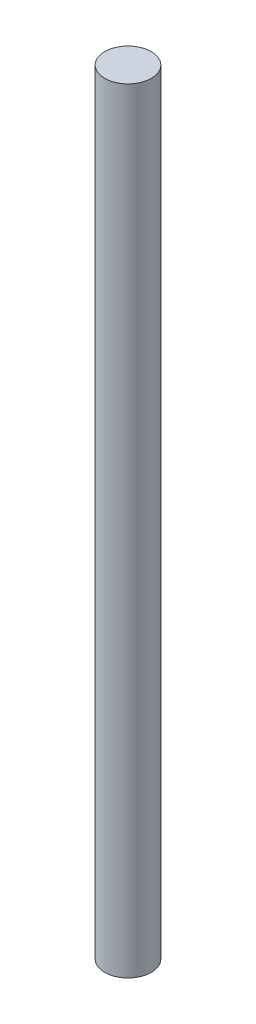
from build123d import *

# Parameters (mm, degrees)
SKIZZE2_R                       = 3
AUFSATZ_LINEAR_AUSTRAGEN1_DEPTH = 100
SKIZZE3_R                       = 1.65
SCHNITT_LINEAR_AUSTRAGEN1_DEPTH = 4


with BuildPart() as part:
    # Skizze2 → Aufsatz-Linear austragen1 (new body)
    with BuildSketch(Plane(origin=(0, 0, 0), x_dir=(1, 0, 0), z_dir=(0, 1, 0))):
        with Locations(Location((0, 0, 0), (0, 0, 270))):
            Circle(SKIZZE2_R)
    extrude(amount=AUFSATZ_LINEAR_AUSTRAGEN1_DEPTH)

    # Skizze3 → Schnitt-Linear austragen1 (cut)
    with BuildSketch(Plane(origin=(0, 0, 0), x_dir=(-1, 0, 0), z_dir=(0, -1, 0))):
        with Locations(Location((0, 0, 0), (0, 0, 90))):
            Circle(SKIZZE3_R)
    extrude(amount=-SCHNITT_LINEAR_AUSTRAGEN1_DEPTH, mode=Mode.SUBTRACT)


solid = part.part
